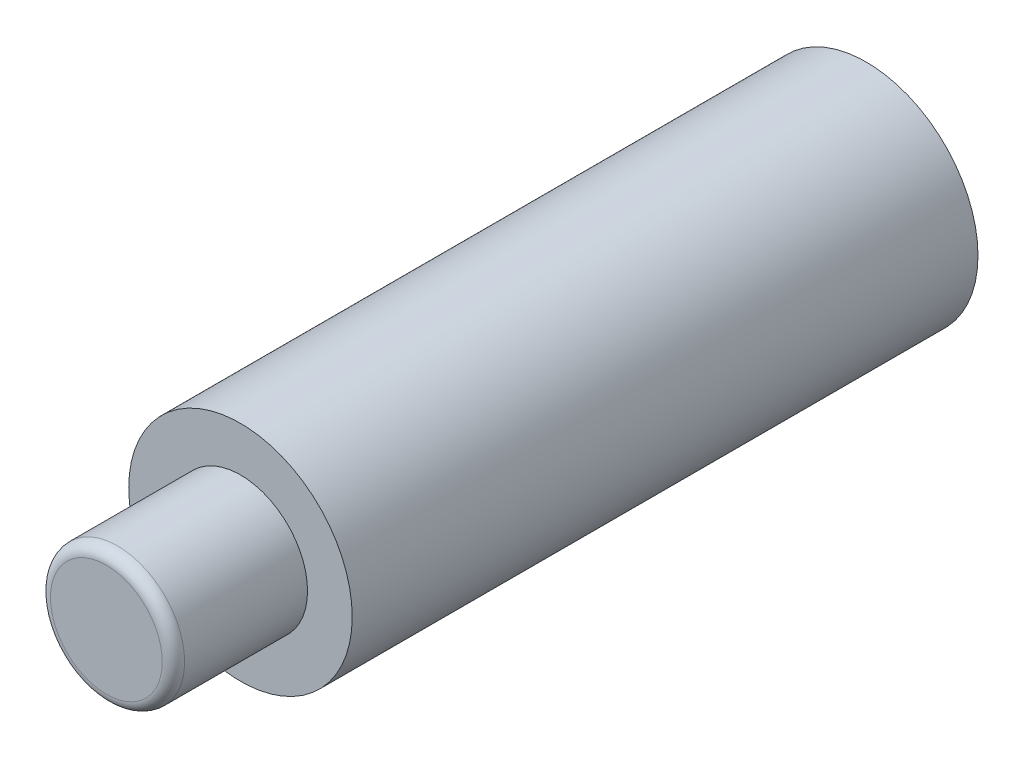
from build123d import *

# Parameters (mm, degrees)
SKETCH_1_R      = 25
EXTRUDE_1_DEPTH = 140
SKETCH_2_R      = 15
EXTRUDE_2_DEPTH = 30
FILLET_1_R      = 2.5


with BuildPart() as part:
    # 스케치1 → 보스-돌출1 (new body)
    with BuildSketch(Plane.XY):
        Circle(SKETCH_1_R)
    extrude(amount=EXTRUDE_1_DEPTH)

    # 스케치2 → 보스-돌출2 (add)
    with BuildSketch(Plane.XY.offset(140)):
        Circle(SKETCH_2_R)
    extrude(amount=EXTRUDE_2_DEPTH)

    # 필렛1
    fillet_1_edges = [part.edges().sort_by_distance(p)[0] for p in [
        (-15, 0, 170),
    ]]
    fillet(fillet_1_edges, radius=FILLET_1_R)


solid = part.part
